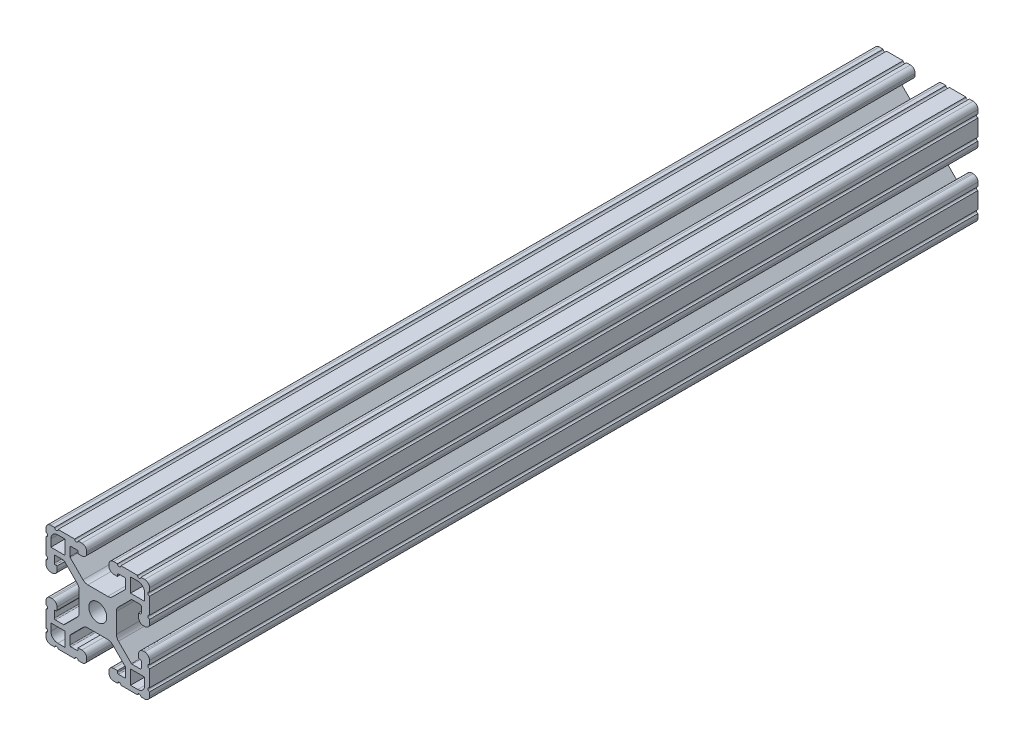
from build123d import *

# Parameters (mm, degrees)
BOSS_EXTRUDE1_DEPTH      = 152.4
BOSS_EXTRUDE1_DEPTH_BACK = 152.4
SKETCH3_W                = 38.1
SKETCH3_H                = 38.1
SKETCH4_W                = 5.207
SKETCH4_H                = 5.207
SKETCH4_R                = 3.302
CUT_EXTRUDE1_DEPTH       = 306.9883086
CUT_EXTRUDE2_DEPTH       = 306.9883086
FILLET1_R                = 2.54
FILLET2_R                = 1.778
FILLET3_R                = 0.396875


with BuildPart() as part:
    # Sketch3 → Boss-Extrude1 (new, two sides: drawn at the far end of the back side and taken through both)
    with BuildSketch(Plane.XY.offset(-BOSS_EXTRUDE1_DEPTH_BACK)):
        Rectangle(SKETCH3_W, SKETCH3_H)
    extrude(amount=BOSS_EXTRUDE1_DEPTH + BOSS_EXTRUDE1_DEPTH_BACK)

    # Sketch4 → Cut-Extrude1 (cut, through all)
    with BuildSketch(Plane.XY.offset(152.4)):
        Polygon((7.239, 14.986), (4.064, 14.986), (4.064, 19.05), (-4.064, 19.05), (-4.064, 14.986), (-7.239, 14.986), (-7.239, 16.002), (-10.287, 16.002), (-10.287, 12.442261469), (-4.702738531, 6.858), (4.702738531, 6.858), (10.287, 12.442261469), (10.287, 16.002), (7.239, 16.002), align=None)
        Polygon((10.287, -12.442261469), (4.702738531, -6.858), (-4.702738531, -6.858), (-10.287, -12.442261469), (-10.287, -16.002), (-7.239, -16.002), (-7.239, -14.986), (-4.064, -14.986), (-4.064, -19.05), (4.064, -19.05), (4.064, -14.986), (7.239, -14.986), (7.239, -16.002), (10.287, -16.002), align=None)
        Polygon((-12.442261469, -10.287), (-6.858, -4.702738531), (-6.858, 4.702738531), (-12.442261469, 10.287), (-16.002, 10.287), (-16.002, 7.239), (-14.986, 7.239), (-14.986, 4.064), (-19.05, 4.064), (-19.05, -4.064), (-14.986, -4.064), (-14.986, -7.239), (-16.002, -7.239), (-16.002, -10.287), align=None)
        Polygon((14.986, -7.239), (14.986, -4.064), (19.05, -4.064), (19.05, 4.064), (14.986, 4.064), (14.986, 7.239), (16.002, 7.239), (16.002, 10.287), (12.442261469, 10.287), (6.858, 4.702738531), (6.858, -4.702738531), (12.442261469, -10.287), (16.002, -10.287), (16.002, -7.239), align=None)
        with Locations((14.6685, 14.6685)):
            Rectangle(SKETCH4_W, SKETCH4_H)
        with Locations((14.6685, -14.6685)):
            Rectangle(SKETCH4_W, SKETCH4_H)
        with Locations((-14.6685, 14.6685)):
            Rectangle(SKETCH4_W, SKETCH4_H)
        with Locations((-14.6685, -14.6685)):
            Rectangle(SKETCH4_W, SKETCH4_H)
        Circle(SKETCH4_R)
    extrude(amount=-CUT_EXTRUDE1_DEPTH, mode=Mode.SUBTRACT)

    # Sketch5 → Cut-Extrude2 (cut, through all)
    with BuildSketch(Plane.XY.offset(152.4)):
        with BuildLine():
            Line((-14.605, 19.05), (-15.875, 19.05))
            ThreePointArc((-15.875, 19.05), (-15.24, 18.415), (-14.605, 19.05))
        make_face()
        with BuildLine():
            Line((-7.239, 19.05), (-8.509, 19.05))
            ThreePointArc((-8.509, 19.05), (-7.874, 18.415), (-7.239, 19.05))
        make_face()
        with BuildLine():
            ThreePointArc((-19.05, 14.605), (-18.415, 15.24), (-19.05, 15.875))
            Line((-19.05, 15.875), (-19.05, 14.605))
        make_face()
        with BuildLine():
            ThreePointArc((-19.05, 7.239), (-18.415, 7.874), (-19.05, 8.509))
            Line((-19.05, 8.509), (-19.05, 7.239))
        make_face()
        with BuildLine():
            ThreePointArc((7.239, 19.05), (7.874, 18.415), (8.509, 19.05))
            Line((8.509, 19.05), (7.239, 19.05))
        make_face()
        with BuildLine():
            ThreePointArc((14.605, 19.05), (15.24, 18.415), (15.875, 19.05))
            Line((15.875, 19.05), (14.605, 19.05))
        make_face()
        with BuildLine():
            Line((19.05, 14.605), (19.05, 15.875))
            ThreePointArc((19.05, 15.875), (18.415, 15.24), (19.05, 14.605))
        make_face()
        with BuildLine():
            Line((19.05, 7.239), (19.05, 8.509))
            ThreePointArc((19.05, 8.509), (18.415, 7.874), (19.05, 7.239))
        make_face()
        with BuildLine():
            ThreePointArc((19.05, -7.239), (18.415, -7.874), (19.05, -8.509))
            Line((19.05, -8.509), (19.05, -7.239))
        make_face()
        with BuildLine():
            ThreePointArc((19.05, -14.605), (18.415, -15.24), (19.05, -15.875))
            Line((19.05, -15.875), (19.05, -14.605))
        make_face()
        with BuildLine():
            Line((14.605, -19.05), (15.875, -19.05))
            ThreePointArc((15.875, -19.05), (15.24, -18.415), (14.605, -19.05))
        make_face()
        with BuildLine():
            Line((7.239, -19.05), (8.509, -19.05))
            ThreePointArc((8.509, -19.05), (7.874, -18.415), (7.239, -19.05))
        make_face()
        with BuildLine():
            ThreePointArc((-7.239, -19.05), (-7.874, -18.415), (-8.509, -19.05))
            Line((-8.509, -19.05), (-7.239, -19.05))
        make_face()
        with BuildLine():
            ThreePointArc((-14.605, -19.05), (-15.24, -18.415), (-15.875, -19.05))
            Line((-15.875, -19.05), (-14.605, -19.05))
        make_face()
        with BuildLine():
            Line((-19.05, -14.605), (-19.05, -15.875))
            ThreePointArc((-19.05, -15.875), (-18.415, -15.24), (-19.05, -14.605))
        make_face()
        with BuildLine():
            Line((-19.05, -7.239), (-19.05, -8.509))
            ThreePointArc((-19.05, -8.509), (-18.415, -7.874), (-19.05, -7.239))
        make_face()
    extrude(amount=-CUT_EXTRUDE2_DEPTH, mode=Mode.SUBTRACT)

    # Fillet1
    fillet1_edges = [part.edges().sort_by_distance(p)[0] for p in [
        (6.858, -4.702738531, 0),
        (6.858, 4.702738531, 0),
        (-17.272, 17.272, 0),
        (-17.272, -17.272, 0),
        (17.272, -17.272, 0),
        (17.272, 17.272, 0),
        (-4.702738531, -6.858, 0),
        (4.702738531, -6.858, 0),
        (-6.858, 4.702738531, 0),
        (-6.858, -4.702738531, 0),
        (4.702738531, 6.858, 0),
        (-4.702738531, 6.858, 0),
    ]]
    fillet(fillet1_edges, radius=FILLET1_R)

    # Fillet2
    fillet2_edges = [part.edges().sort_by_distance(p)[0] for p in [
        (14.986, 4.064, 0),
        (19.05, 4.064, 0),
        (19.05, -4.064, 0),
        (14.986, -4.064, 0),
        (4.064, -14.986, 0),
        (4.064, -19.05, 0),
        (-4.064, -19.05, 0),
        (-4.064, -14.986, 0),
        (-14.986, -4.064, 0),
        (-19.05, -4.064, 0),
        (-19.05, 4.064, 0),
        (-14.986, 4.064, 0),
        (-19.05, 19.05, 0),
        (19.05, 19.05, 0),
        (19.05, -19.05, 0),
        (-19.05, -19.05, 0),
        (-4.064, 14.986, 0),
        (-4.064, 19.05, 0),
        (4.064, 19.05, 0),
        (4.064, 14.986, 0),
    ]]
    fillet(fillet2_edges, radius=FILLET2_R)

    # Fillet3
    fillet3_edges = [part.edges().sort_by_distance(p)[0] for p in [
        (12.442261469, 10.287, 0),
        (16.002, 10.287, 0),
        (16.002, 7.239, 0),
        (16.002, -7.239, 0),
        (16.002, -10.287, 0),
        (12.442261469, -10.287, 0),
        (-7.239, -16.002, 0),
        (-10.287, -16.002, 0),
        (-10.287, -12.442261469, 0),
        (10.287, -12.442261469, 0),
        (10.287, -16.002, 0),
        (7.239, -16.002, 0),
        (-16.002, 7.239, 0),
        (-16.002, 10.287, 0),
        (-12.442261469, 10.287, 0),
        (-12.442261469, -10.287, 0),
        (-16.002, -10.287, 0),
        (-14.986, -7.239, 0),
        (-10.287, 12.442261469, 0),
        (-10.287, 16.002, 0),
        (-7.239, 16.002, 0),
        (7.239, 16.002, 0),
        (10.287, 16.002, 0),
        (10.287, 12.442261469, 0),
    ]]
    fillet(fillet3_edges, radius=FILLET3_R)


solid = part.part
